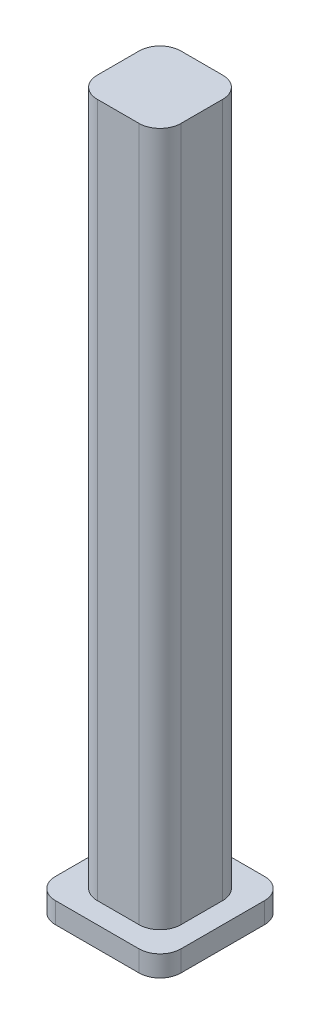
from build123d import *

# Parameters (mm, degrees)
SKETCH1_W           = 60
SKETCH1_H           = 60
BOSS_EXTRUDE1_DEPTH = 10
SKETCH2_W           = 40
SKETCH2_H           = 40
BOSS_EXTRUDE2_DEPTH = 341.83195
FILLET1_R           = 10


with BuildPart() as part:
    # Sketch1 → Boss-Extrude1 (new body)
    with BuildSketch(Plane(origin=(0, 0, 0), x_dir=(1, 0, 0), z_dir=(0, 1, 0))):
        Rectangle(SKETCH1_W, SKETCH1_H)
    extrude(amount=BOSS_EXTRUDE1_DEPTH)

    # Sketch2 → Boss-Extrude2 (add)
    with BuildSketch(Plane(origin=(0, 0, 0), x_dir=(1, 0, 0), z_dir=(0, 1, 0))):
        Rectangle(SKETCH2_W, SKETCH2_H)
    extrude(amount=BOSS_EXTRUDE2_DEPTH)

    # Fillet1
    fillet1_edges = [part.edges().sort_by_distance(p)[0] for p in [
        (20, 175.915975, 20),
        (20, 175.915975, -20),
        (-20, 175.915975, -20),
        (-20, 175.915975, 20),
        (30, 5, 30),
        (-30, 5, 30),
        (-30, 5, -30),
        (30, 5, -30),
    ]]
    fillet(fillet1_edges, radius=FILLET1_R)


solid = part.part
